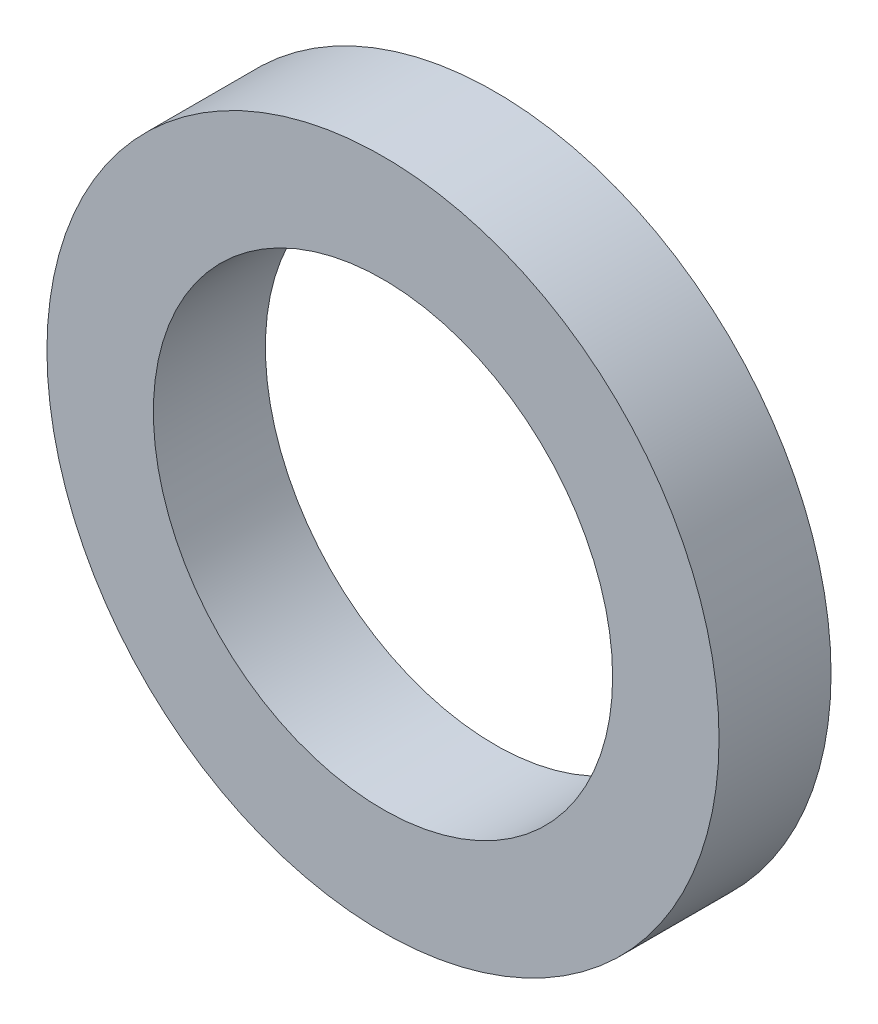
from build123d import *

# Parameters (mm, degrees)
SKETCH_1_R      = 6
SKETCH_1_R_2    = 4.1
EXTRUDE_1_DEPTH = 2


with BuildPart() as part:
    # 草图1 → 凸台-拉伸1 (new body)
    with BuildSketch(Plane.XY):
        Circle(SKETCH_1_R)
        Circle(SKETCH_1_R_2, mode=Mode.SUBTRACT)
    extrude(amount=EXTRUDE_1_DEPTH)


solid = part.part
